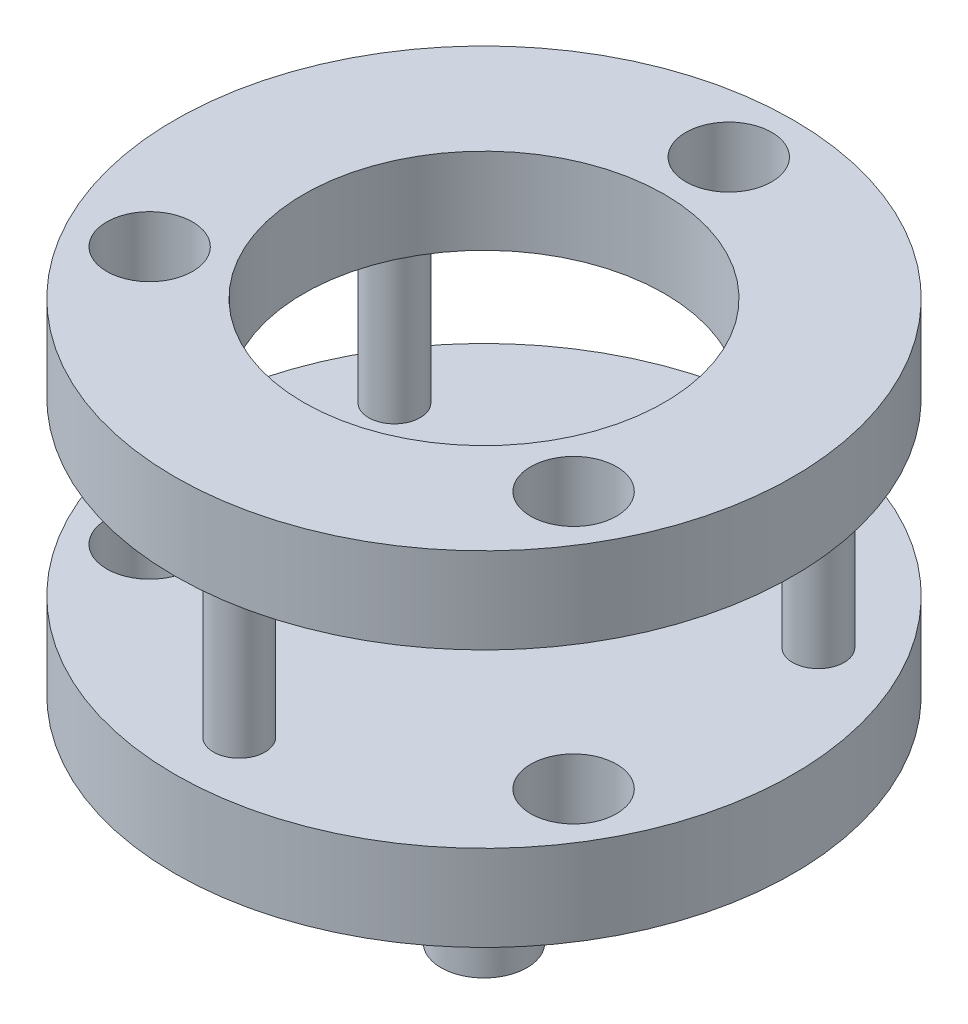
from build123d import *

# Parameters (mm, degrees)
SKETCH1_R           = 36
SKETCH1_R_2         = 5
SKETCH1_R_3         = 3
SKETCH1_R_4         = 21
BOSS_EXTRUDE1_DEPTH = 10
SKETCH1_3_R         = 3
BOSS_EXTRUDE2_DEPTH = 40
LPATTERN3_COUNT     = 2
LPATTERN3_PITCH     = 30
SKETCH2_R           = 21
BOSS_EXTRUDE3_DEPTH = 10
SKETCH4_R           = 5
BOSS_EXTRUDE4_DEPTH = 25
FILLET1_R           = 10


with BuildPart() as part:
    # Sketch1 → Boss-Extrude1 (new body)
    with BuildSketch(Plane(origin=(0, 0, 0), x_dir=(1, 0, 0), z_dir=(0, 1, 0))):
        Circle(SKETCH1_R)
        with Locations((0, 28.5)):
            Circle(SKETCH1_R_2, mode=Mode.SUBTRACT)
        with Locations((24.681724008, 14.25)):
            Circle(SKETCH1_R_3, mode=Mode.SUBTRACT)
        with Locations((24.681724008, -14.25)):
            Circle(SKETCH1_R_2, mode=Mode.SUBTRACT)
        with Locations((0, -28.5)):
            Circle(SKETCH1_R_3, mode=Mode.SUBTRACT)
        with Locations((-24.681724008, -14.25)):
            Circle(SKETCH1_R_2, mode=Mode.SUBTRACT)
        with Locations((-24.681724008, 14.25)):
            Circle(SKETCH1_R_3, mode=Mode.SUBTRACT)
        Circle(SKETCH1_R_4, mode=Mode.SUBTRACT)
    boss_extrude1 = extrude(amount=BOSS_EXTRUDE1_DEPTH)

    # Sketch1<3> → Boss-Extrude2 (add)
    with BuildSketch(Plane(origin=(0, 0, 0), x_dir=(1, 0, 0), z_dir=(0, 1, 0))):
        with Locations((0, -28.5)):
            Circle(SKETCH1_3_R)
        with Locations((-24.681724008, 14.25)):
            Circle(SKETCH1_3_R)
        with Locations((24.681724008, 14.25)):
            Circle(SKETCH1_3_R)
    extrude(amount=BOSS_EXTRUDE2_DEPTH)

    # LPattern3: Boss-Extrude1 ×2
    with Locations(*[(0, i * LPATTERN3_PITCH, 0) for i in range(1, LPATTERN3_COUNT)]):
        add(boss_extrude1)

    # Sketch2 → Boss-Extrude3 (add)
    with BuildSketch(Plane.XZ):
        Circle(SKETCH2_R)
    extrude(amount=-BOSS_EXTRUDE3_DEPTH)

    # Sketch4 → Boss-Extrude4 (add)
    with BuildSketch(Plane.XZ):
        Circle(SKETCH4_R)
    extrude(amount=BOSS_EXTRUDE4_DEPTH)

    # Fillet1
    fillet1_edges = [part.edges().sort_by_distance(p)[0] for p in [
        (-5, 0, 0),
    ]]
    fillet(fillet1_edges, radius=FILLET1_R)


solid = part.part
